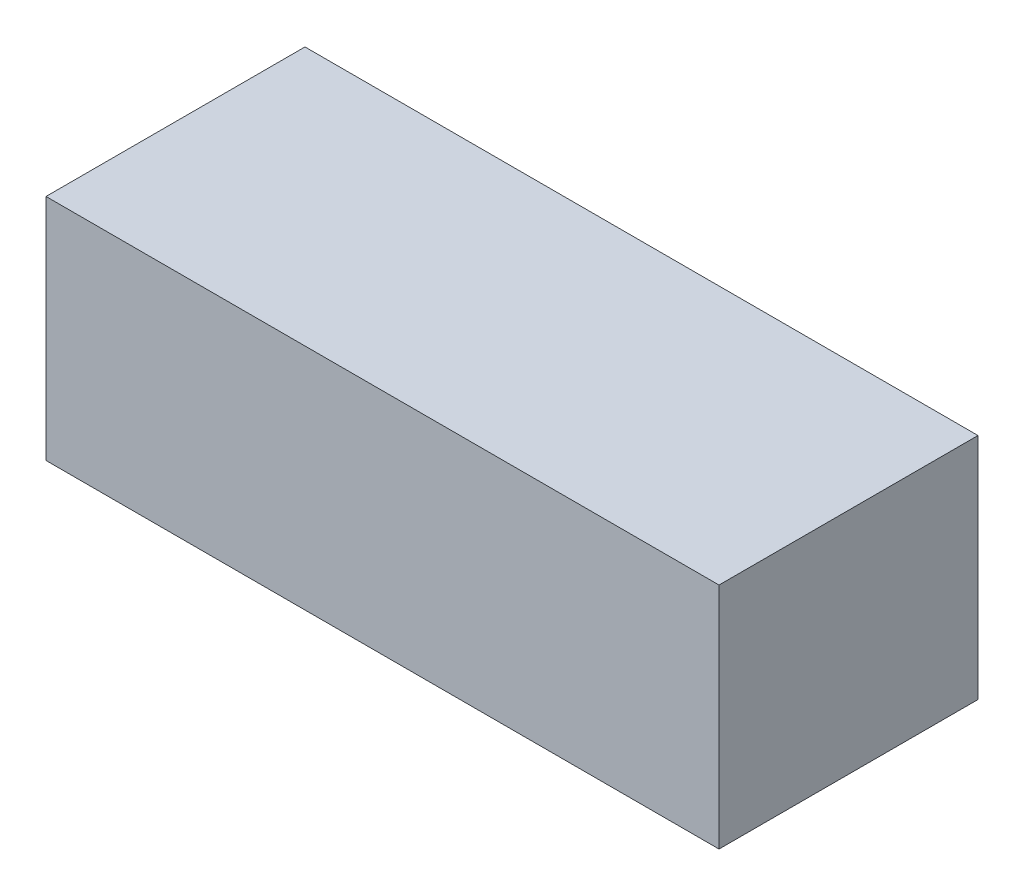
from build123d import *

# Parameters (mm, degrees)
SKETCH_1_W      = 58.86228
SKETCH_1_H      = 22.65
EXTRUDE_1_DEPTH = 20


with BuildPart() as part:
    # 草图1 → 凸台-拉伸1 (new body)
    with BuildSketch(Plane(origin=(0, 0, 0), x_dir=(1, 0, 0), z_dir=(0, 1, 0))):
        with Locations((29.43114, 11.325)):
            Rectangle(SKETCH_1_W, SKETCH_1_H)
    extrude(amount=EXTRUDE_1_DEPTH)


solid = part.part
